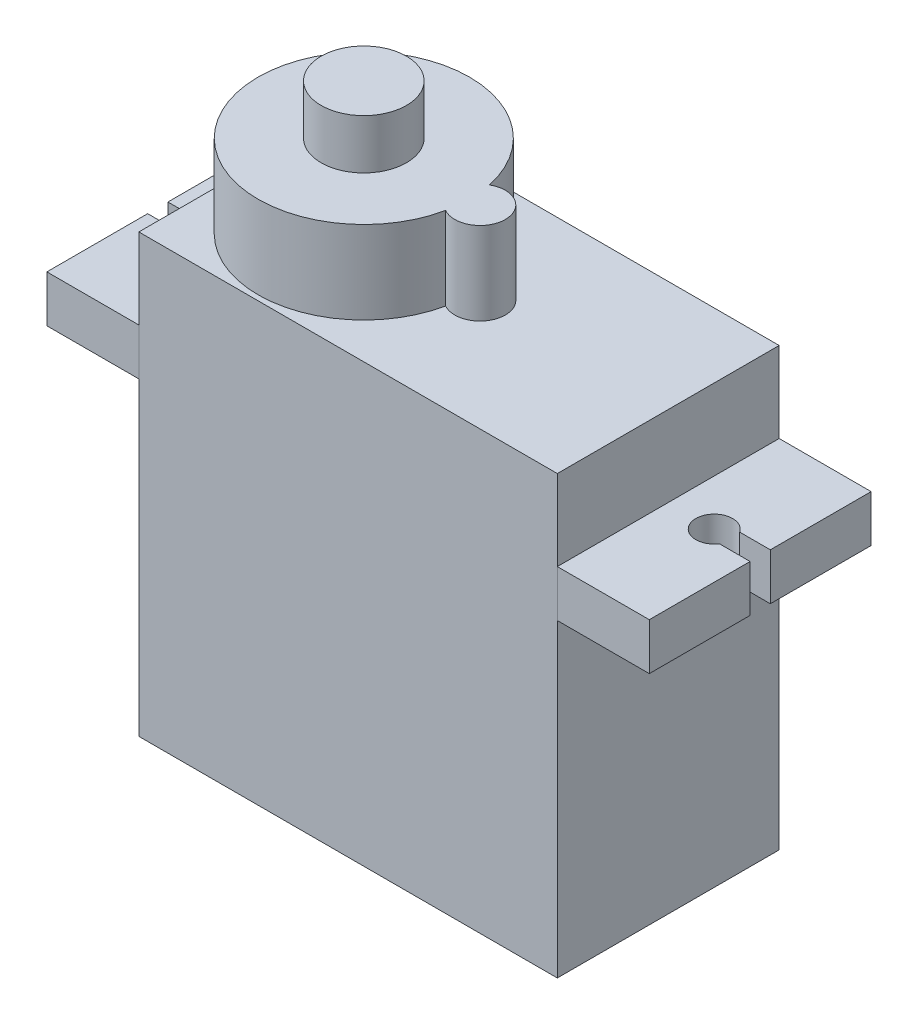
from build123d import *

# Parameters (mm, degrees)
SKETCH1_W             = 22.75
SKETCH1_H             = 12.06
BOSS_EXTRUDE1_DEPTH   = 23.75
SKETCH2_W             = 12.06
SKETCH2_H             = 2.54
BOSS_EXTRUDE2_DEPTH   = 5
SKETCH3_W             = 12.06
SKETCH3_H             = 2.54
BOSS_EXTRUDE3_DEPTH   = 5
CUT_EXTRUDE1_DEPTH    = 2.54
CUT_EXTRUDE2_DEPTH    = 2.54
BOSS_EXTRUDE4_DEPTH   = 4.5
SKETCH7_R             = 2.32
BOSS_EXTRUDE5_DEPTH   = 2.7
SKETCH8_R             = 0.6
BOSS_EXTRUDE7_DEPTH   = 2.3
BOSS_EXTRUDE7_2_DEPTH = 2.3
BOSS_EXTRUDE7_3_DEPTH = 2.3


with BuildPart() as part:
    # Sketch1 → Boss-Extrude1 (new body)
    with BuildSketch(Plane(origin=(0, 0, 0), x_dir=(1, 0, 0), z_dir=(0, 1, 0))):
        Rectangle(SKETCH1_W, SKETCH1_H)
    extrude(amount=BOSS_EXTRUDE1_DEPTH)

    # Sketch6 → Boss-Extrude4 (add)
    with BuildSketch(Plane(origin=(0, 23.75, 0), x_dir=(1, 0, 0), z_dir=(0, 1, 0))):
        with BuildLine():
            ThreePointArc((0.452610218, -1.180043744), (2.49996378, 0.023579109), (0.445253368, 1.214599556))
            ThreePointArc((0.445253368, 1.214599556), (-10.924972865, -0.017665131), (0.452610218, -1.180043744))
        make_face()
    extrude(amount=BOSS_EXTRUDE4_DEPTH)

    # Sketch7 → Boss-Extrude5 (add)
    with BuildSketch(Plane(origin=(0, 28.25, 0), x_dir=(1, 0, 0), z_dir=(0, 1, 0))):
        with Locations(Location((-5.175, 0, 0), (0, 0, 90))):
            Circle(SKETCH7_R)
    extrude(amount=BOSS_EXTRUDE5_DEPTH)


with BuildPart() as body_2:
    # Sketch2 → Boss-Extrude2 (new body)
    with BuildSketch(Plane(origin=(11.375, 0, 0), x_dir=(0, 0, -1), z_dir=(1, 0, 0))):
        with Locations((0, 18.1)):
            Rectangle(SKETCH2_W, SKETCH2_H)
    extrude(amount=BOSS_EXTRUDE2_DEPTH)

    # Sketch5 → Cut-Extrude2 (cut)
    with BuildSketch(Plane(origin=(0, 19.37, 0), x_dir=(1, 0, 0), z_dir=(0, 1, 0))):
        with BuildLine():
            Line((14.710164654, 0.55), (16.375, 0.55))
            Line((16.375, 0.55), (16.375, -0.55))
            Line((16.375, -0.55), (14.710164654, -0.55))
            ThreePointArc((14.710164654, -0.55), (12.875, 0), (14.710164654, 0.55))
        make_face()
    extrude(amount=-CUT_EXTRUDE2_DEPTH, mode=Mode.SUBTRACT)


with BuildPart() as body_3:
    # Sketch3 → Boss-Extrude3 (new body)
    with BuildSketch(Plane.ZY.offset(11.375)):
        with Locations((0, 18.1)):
            Rectangle(SKETCH3_W, SKETCH3_H)
    extrude(amount=BOSS_EXTRUDE3_DEPTH)

    # Sketch4 → Cut-Extrude1 (cut)
    with BuildSketch(Plane(origin=(0, 19.37, 0), x_dir=(1, 0, 0), z_dir=(0, 1, 0))):
        with BuildLine():
            Line((-16.375, 0.55), (-14.710164654, 0.55))
            ThreePointArc((-14.710164654, 0.55), (-12.875, 0), (-14.710164654, -0.55))
            Line((-14.710164654, -0.55), (-16.375, -0.55))
            Line((-16.375, -0.55), (-16.375, 0.55))
        make_face()
        with BuildLine():
            Line((16.375, -0.55), (14.710164654, -0.55))
            ThreePointArc((14.710164654, -0.55), (12.875, 0), (14.710164654, 0.55))
            Line((14.710164654, 0.55), (16.375, 0.55))
            Line((16.375, 0.55), (16.375, -0.55))
        make_face()
    extrude(amount=-CUT_EXTRUDE1_DEPTH, mode=Mode.SUBTRACT)


with BuildPart() as body_4:
    # Sketch8 → Boss-Extrude7 (new body)
    with BuildSketch(Plane.ZY.offset(11.375)):
        with Locations((0, 4.5)):
            Circle(SKETCH8_R)
    extrude(amount=BOSS_EXTRUDE7_DEPTH)


with BuildPart() as body_5:
    # Sketch8 → Boss-Extrude7 2 (new body)
    with BuildSketch(Plane.ZY.offset(11.375)):
        with Locations((-1.2, 4.5)):
            Circle(SKETCH8_R)
    extrude(amount=BOSS_EXTRUDE7_2_DEPTH)


with BuildPart() as body_6:
    # Sketch8 → Boss-Extrude7 3 (new body)
    with BuildSketch(Plane.ZY.offset(11.375)):
        with Locations((1.2, 4.5)):
            Circle(SKETCH8_R)
    extrude(amount=BOSS_EXTRUDE7_3_DEPTH)


solid = Compound([part.part, body_2.part, body_3.part, body_4.part, body_5.part, body_6.part])
